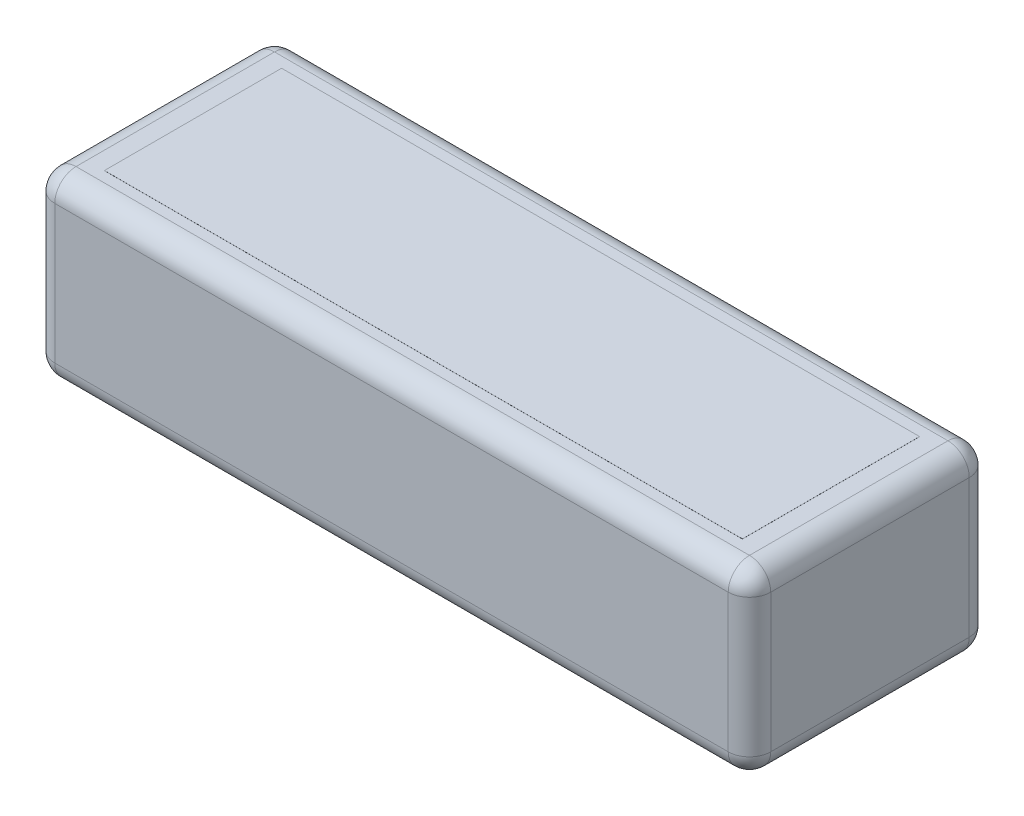
from build123d import *

# Parameters (mm, degrees)
SKETCH1_W           = 101
SKETCH1_H           = 34
BOSS_EXTRUDE1_DEPTH = 25.5
SKETCH2_W           = 90
SKETCH2_H           = 25
BOSS_EXTRUDE2_DEPTH = 0.01
FILLET1_R           = 3


with BuildPart() as part:
    # Sketch1 → Boss-Extrude1 (new body)
    with BuildSketch(Plane(origin=(0, 0, 0), x_dir=(1, 0, 0), z_dir=(0, 1, 0))):
        Rectangle(SKETCH1_W, SKETCH1_H)
    extrude(amount=BOSS_EXTRUDE1_DEPTH)

    # Sketch2 → Boss-Extrude2 (add)
    with BuildSketch(Plane(origin=(0, 25.5, 0), x_dir=(1, 0, 0), z_dir=(0, 1, 0))):
        Rectangle(SKETCH2_W, SKETCH2_H)
    extrude(amount=BOSS_EXTRUDE2_DEPTH)

    # Fillet1
    fillet1_edges = [part.edges().sort_by_distance(p)[0] for p in [
        (50.5, 25.5, 0),
        (0, 25.5, -17),
        (-50.5, 25.5, 0),
        (0, 0, -17),
        (50.5, 0, 0),
        (0, 0, 17),
        (-50.5, 0, 0),
        (0, 25.5, 17),
        (-50.5, 12.75, -17),
        (50.5, 12.75, -17),
        (50.5, 12.75, 17),
        (-50.5, 12.75, 17),
    ]]
    fillet(fillet1_edges, radius=FILLET1_R)


solid = part.part
